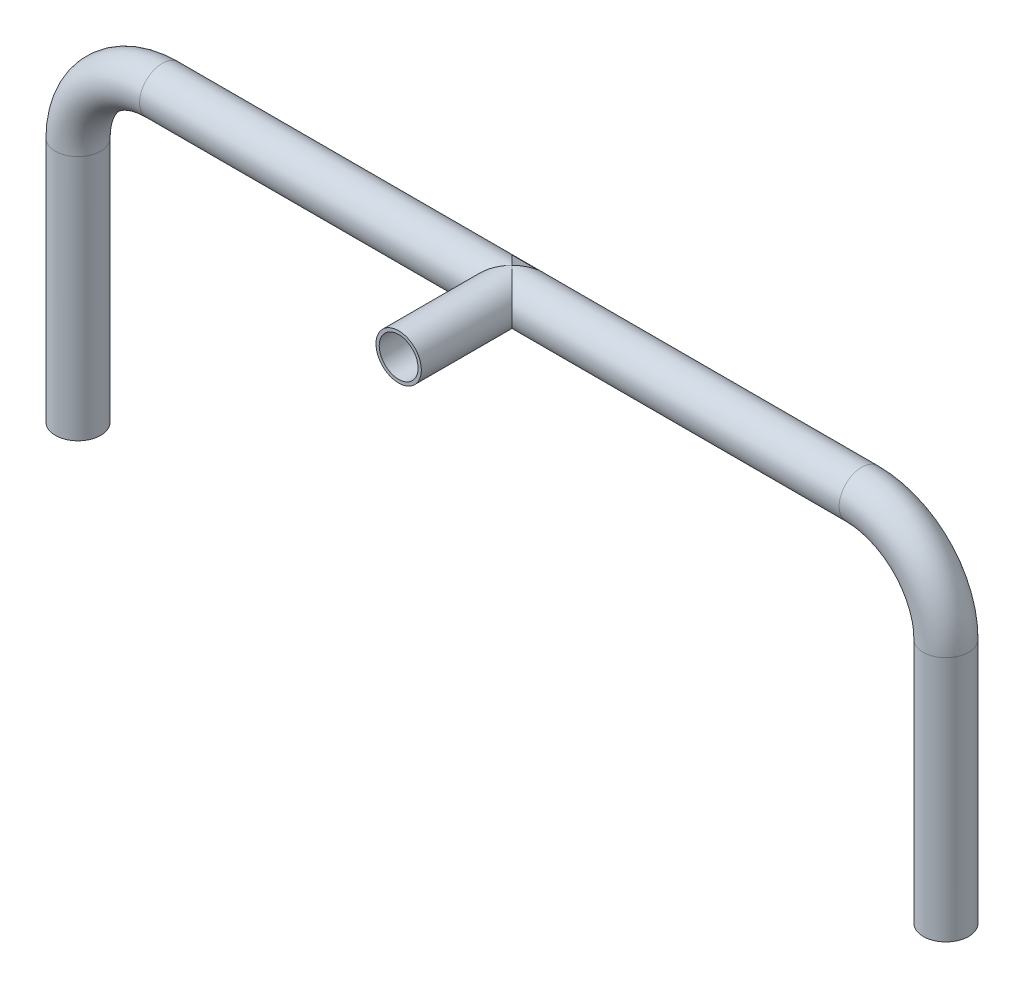
from build123d import *

# Parameters (mm, degrees)
SWEEP_THIN2_PROFILE_R   = 3.5
SWEEP_THIN2_PROFILE_R_2 = 2.5
SKETCH57_R              = 3.5
SKETCH57_R_2            = 3
BOSS_EXTRUDE1_DEPTH     = 17.5
CUT_EXTRUDE1_START      = -2
SKETCH59_R              = 3.5
CUT_EXTRUDE1_DEPTH      = 2


with BuildPart() as part:
    # Sweep-Thin2: sweep along a path in Sketch28
    with BuildLine(Plane.XY) as sweep_thin2_path:
        Line((-67, -51), (-67, -13))
        ThreePointArc((-67, -13), (-63.192388155, -3.807611845), (-54, 0))
        Line((-54, 0), (54, 0))
        ThreePointArc((54, 0), (63.192388155, -3.807611845), (67, -13))
        Line((67, -13), (67, -51))
    # Sweep-Thin2 profile (on start of the path) → Sweep-Thin2 (sweep)
    with BuildSketch(Plane(origin=(-67, -51, 0), x_dir=(1, 0, 0), z_dir=(0, 1, 0))):
        Circle(SWEEP_THIN2_PROFILE_R)
        Circle(SWEEP_THIN2_PROFILE_R_2, mode=Mode.SUBTRACT)
    sweep(path=sweep_thin2_path.line)

    # Sketch57 → Boss-Extrude1 (add)
    with BuildSketch(Plane.XY):
        with Locations(Location((0, 0, 0), (0, 0, 270))):
            Circle(SKETCH57_R)
        with Locations(Location((0, 0, 0), (0, 0, 180))):
            Circle(SKETCH57_R_2, mode=Mode.SUBTRACT)
    extrude(amount=BOSS_EXTRUDE1_DEPTH)

    # Sketch59 → Cut-Extrude1 (cut)
    with BuildSketch(Plane.XY.offset(CUT_EXTRUDE1_START)):
        with Locations(Location((0, 0, 0), (0, 0, 270))):
            Circle(SKETCH59_R)
    extrude(amount=CUT_EXTRUDE1_DEPTH, mode=Mode.SUBTRACT)


solid = part.part
